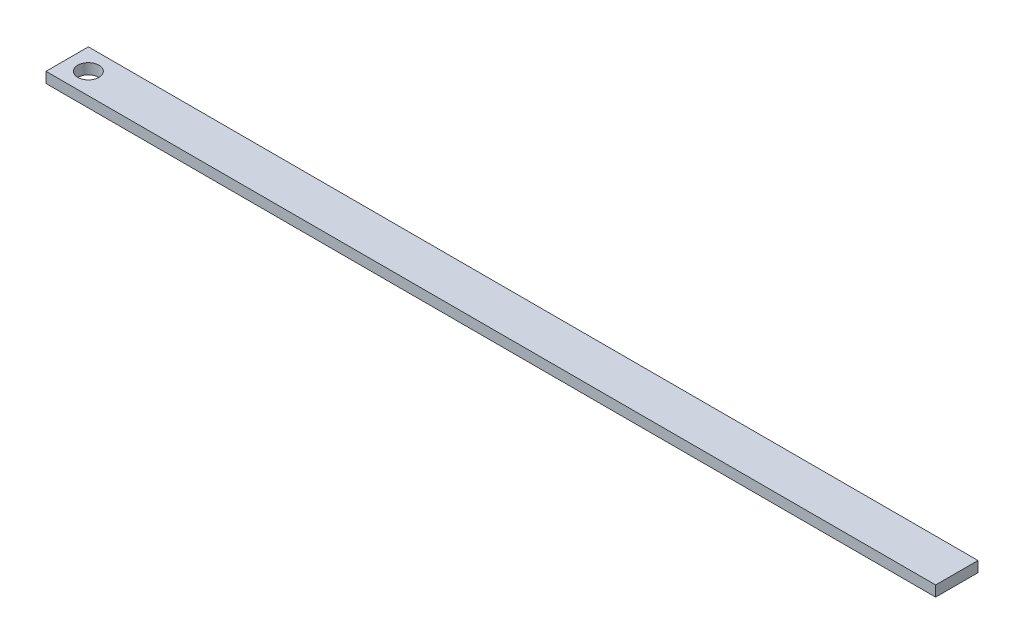
from build123d import *

# Parameters (mm, degrees)
CONTACT_BODY_SKETCH_W = 21
CONTACT_BODY_SKETCH_H = 1
CONTACT_BODY_SKETCH_R = 0.25
CONTACT_BODY_DEPTH    = 0.25


with BuildPart() as part:
    # Contact_body_sketch → Contact_body (new body)
    with BuildSketch(Plane(origin=(0, 0, 0), x_dir=(1, 0, 0), z_dir=(0, 1, 0))):
        Rectangle(CONTACT_BODY_SKETCH_W, CONTACT_BODY_SKETCH_H)
        with Locations(Location((-10, 0, 0), (0, 0, 270))):
            Circle(CONTACT_BODY_SKETCH_R, mode=Mode.SUBTRACT)
    extrude(amount=CONTACT_BODY_DEPTH)


solid = part.part
